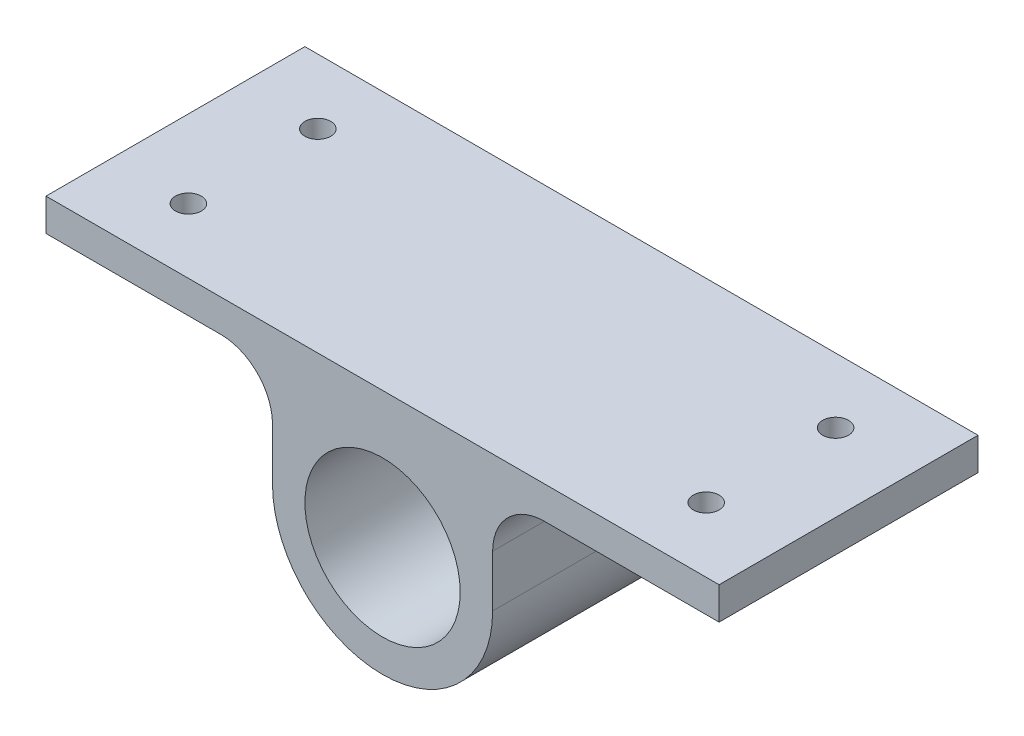
from build123d import *

# Parameters (mm, degrees)
SKETCH1_R           = 19.05
BOSS_EXTRUDE1_DEPTH = 31.75
SKETCH2_R           = 3.175
CUT_EXTRUDE1_DEPTH  = 108.073506434


with BuildPart() as part:
    # Sketch1 → Boss-Extrude1 (new, symmetric)
    with BuildSketch(Plane.XY):
        with BuildLine():
            Line((-82.55, 33.3502), (-82.55, 25.4))
            Line((-82.55, 25.4), (-39.7002, 25.4))
            ThreePointArc((-39.7002, 25.4), (-30.719943879, 21.680256121), (-27.0002, 12.7))
            Line((-27.0002, 12.7), (-27.0002, 0))
            ThreePointArc((-27.0002, 0), (0, -27.0002), (27.0002, 0))
            Line((27.0002, 0), (27.0002, 12.7))
            ThreePointArc((27.0002, 12.7), (30.719943879, 21.680256121), (39.7002, 25.4))
            Line((39.7002, 25.4), (82.55, 25.4))
            Line((82.55, 25.4), (82.55, 33.3502))
            Line((82.55, 33.3502), (-82.55, 33.3502))
        make_face()
        Circle(SKETCH1_R, mode=Mode.SUBTRACT)
    extrude(amount=BOSS_EXTRUDE1_DEPTH, both=True)

    # Sketch2 → Cut-Extrude1 (cut, through all)
    with BuildSketch(Plane(origin=(0, 33.3502, 0), x_dir=(1, 0, 0), z_dir=(0, 1, 0))):
        with Locations(Location((-63.5, 15.875, 0), (0, 0, 180))):
            Circle(SKETCH2_R)
        with Locations(Location((-63.5, -15.875, 0), (0, 0, 180))):
            Circle(SKETCH2_R)
        with Locations(Location((63.5, -15.875, 0), (0, 0, 180))):
            Circle(SKETCH2_R)
        with Locations(Location((63.5, 15.875, 0), (0, 0, 180))):
            Circle(SKETCH2_R)
    extrude(amount=-CUT_EXTRUDE1_DEPTH, mode=Mode.SUBTRACT)


solid = part.part
